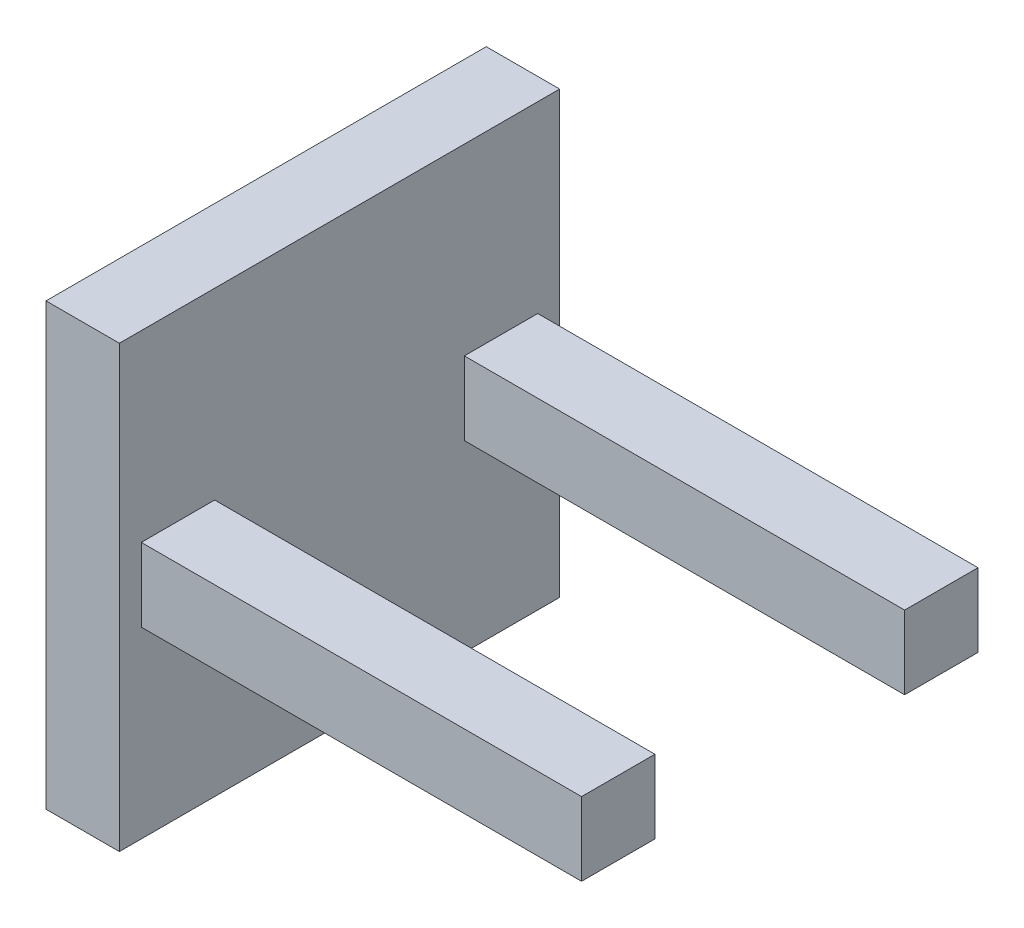
from build123d import *

# Parameters (mm, degrees)
SKETCH1_W           = 30
SKETCH1_H           = 30
BOSS_EXTRUDE1_DEPTH = 5
SKETCH2_W           = 30
SKETCH2_H           = 5
BOSS_EXTRUDE2_DEPTH = 2.5


with BuildPart() as part:
    # Sketch1 → Boss-Extrude1 (new body)
    with BuildSketch(Plane(origin=(0, 0, 0), x_dir=(0, 0, -1), z_dir=(1, 0, 0))):
        Rectangle(SKETCH1_W, SKETCH1_H)
    extrude(amount=BOSS_EXTRUDE1_DEPTH)

    # Sketch2 → Boss-Extrude2 (add, symmetric)
    with BuildSketch(Plane(origin=(0, 0, 0), x_dir=(1, 0, 0), z_dir=(0, 1, 0))):
        with Locations((20, 11.007087783)):
            Rectangle(SKETCH2_W, SKETCH2_H)
        with Locations((20, -11.007087783)):
            Rectangle(SKETCH2_W, SKETCH2_H)
    extrude(amount=BOSS_EXTRUDE2_DEPTH, both=True)


solid = part.part
